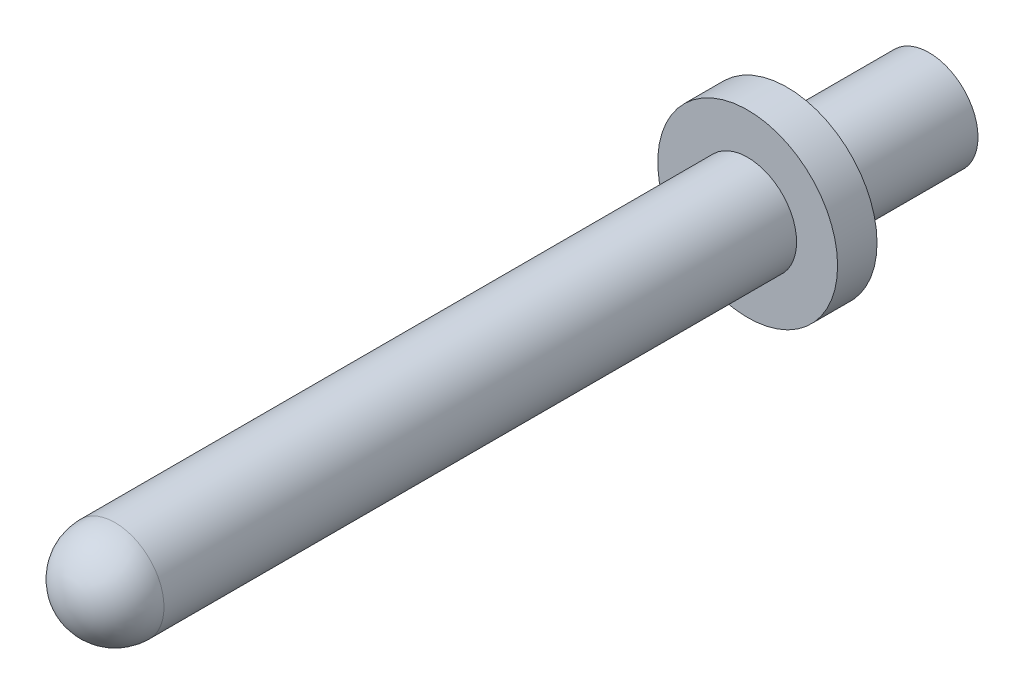
from build123d import *
from build123d.topology import SkipClean

# Parameters (mm, degrees)
SKETCH1_W = 0.2413
SKETCH1_H = 2.286


with BuildPart() as part:
    # Sketch1 → Revolve1 (revolve)
    with SkipClean():  # the faces are left unmerged after this step: merging them gives an invalid solid
        with BuildSketch(Plane(origin=(0, 0, 0), x_dir=(1, 0, 0), z_dir=(0, 1, 0))):
            with BuildLine():
                ThreePointArc((0.7874, 0.7874), (0.55677588, 1.34417588), (0, 1.5748))
                Line((0, 1.5748), (0, 0))
                ThreePointArc((0, 0), (0.55677588, 0.23062412), (0.7874, 0.7874))
            make_face()
            with BuildLine():
                Line((0, 0), (0, 1.5748))
                ThreePointArc((0, 1.5748), (-0.7874, 0.7874), (0, 0))
            make_face()
            with BuildLine():
                Line((0.7874, 10.9728), (0, 10.9728))
                Line((0, 10.9728), (0, 1.5748))
                ThreePointArc((0, 1.5748), (0.55677588, 1.34417588), (0.7874, 0.7874))
                Line((0.7874, 0.7874), (0.7874, 10.9728))
            make_face()
            Polygon((0.7874, 11.6078), (0.5461, 11.6078), (0, 11.2903), (0, 10.9728), (0.7874, 10.9728), (1.4478, 10.9728), (1.4478, 11.6078), align=None)
            with Locations((0.66675, 12.7508)):
                Rectangle(SKETCH1_W, SKETCH1_H)
        revolve(axis=Axis((0, 0, 0), (0, 0, -1)))


solid = part.part
